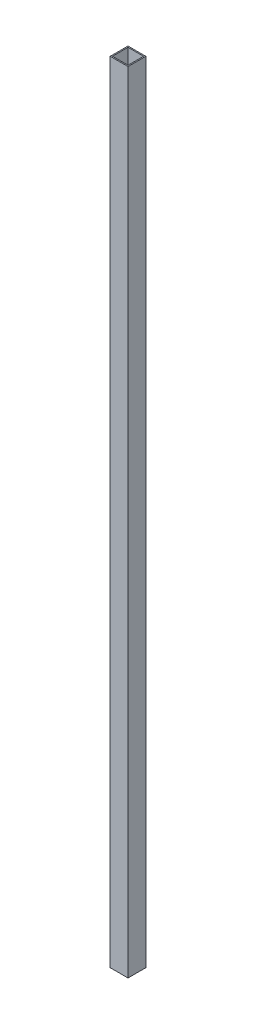
from build123d import *

# Parameters (mm, degrees)
SKETCH1_W           = 50.8
SKETCH1_H           = 50.8
SKETCH1_W_2         = 44.45
SKETCH1_H_2         = 44.45
BOSS_EXTRUDE1_DEPTH = 2254.25


with BuildPart() as part:
    # Sketch1 → Boss-Extrude1 (new body)
    with BuildSketch(Plane(origin=(0, 0, 0), x_dir=(1, 0, 0), z_dir=(0, 1, 0))):
        Rectangle(SKETCH1_W, SKETCH1_H)
        Rectangle(SKETCH1_W_2, SKETCH1_H_2, mode=Mode.SUBTRACT)
    extrude(amount=BOSS_EXTRUDE1_DEPTH)


solid = part.part
